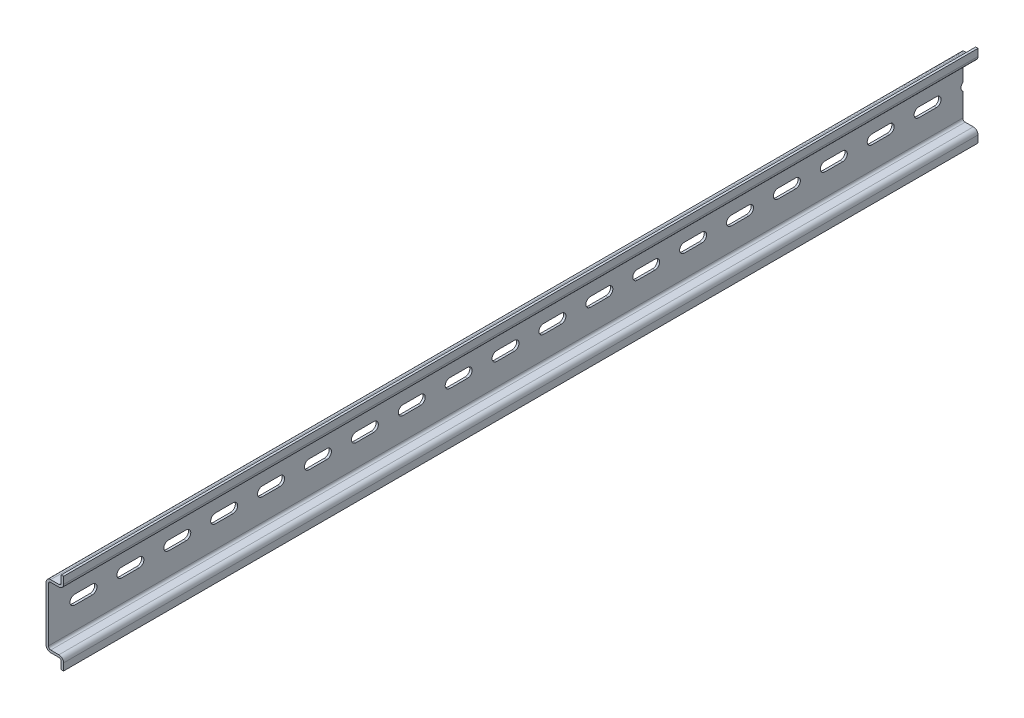
from build123d import *

# Parameters (mm, degrees)
EXTRUDE_1_DEPTH        = 195
CUT_EXTRUDE_1_DEPTH    = 10
PATTERN_LINEAR_1_COUNT = 50
PATTERN_LINEAR_1_PITCH = 20


with BuildPart() as part:
    # 草图1 → 凸台-拉伸1 (new, symmetric)
    with BuildSketch(Plane.XY):
        with BuildLine():
            Line((0, 19.218912653), (1, 19.218912653))
            Line((1, 19.218912653), (1, 16.218912653))
            ThreePointArc((1, 16.218912653), (0.414213562, 14.80469909), (-1, 14.218912653))
            Line((-1, 14.218912653), (-4.5, 14.218912653))
            ThreePointArc((-4.5, 14.218912653), (-5.207106781, 13.926019434), (-5.5, 13.218912653))
            Line((-5.5, 13.218912653), (-5.5, -9.781087347))
            ThreePointArc((-5.5, -9.781087347), (-5.207106781, -10.488194128), (-4.5, -10.781087347))
            Line((-4.5, -10.781087347), (-1, -10.781087347))
            ThreePointArc((-1, -10.781087347), (0.414213562, -11.366873785), (1, -12.781087347))
            Line((1, -12.781087347), (1, -15.781087347))
            Line((1, -15.781087347), (0, -15.781087347))
            Line((0, -15.781087347), (0, -12.781087347))
            ThreePointArc((0, -12.781087347), (-0.292893219, -12.073980566), (-1, -11.781087347))
            Line((-1, -11.781087347), (-4.5, -11.781087347))
            ThreePointArc((-4.5, -11.781087347), (-5.914213562, -11.19530091), (-6.5, -9.781087347))
            Line((-6.5, -9.781087347), (-6.5, 13.218912653))
            ThreePointArc((-6.5, 13.218912653), (-5.914213562, 14.633126215), (-4.5, 15.218912653))
            Line((-4.5, 15.218912653), (-1, 15.218912653))
            ThreePointArc((-1, 15.218912653), (-0.292893219, 15.511805872), (0, 16.218912653))
            Line((0, 16.218912653), (0, 19.218912653))
        make_face()
    extrude(amount=EXTRUDE_1_DEPTH, both=True)

    # 草图2 → 切除-拉伸1 (cut)
    with BuildSketch(Plane(origin=(-5.5, 0, 0), x_dir=(0, 0, -1), z_dir=(1, 0, 0))):
        with BuildLine():
            Line((-183.75, 3.718912653), (-176.25, 3.718912653))
            ThreePointArc((-176.25, 3.718912653), (-174.25, 1.718912653), (-176.25, -0.281087347))
            Line((-176.25, -0.281087347), (-183.75, -0.281087347))
            ThreePointArc((-183.75, -0.281087347), (-185.75, 1.718912653), (-183.75, 3.718912653))
        make_face()
    cut_extrude_1 = extrude(amount=-CUT_EXTRUDE_1_DEPTH, mode=Mode.SUBTRACT)

    # 阵列(线性)1: 切除-拉伸1 ×50
    with Locations(*[(0, 0, -i * PATTERN_LINEAR_1_PITCH) for i in range(1, PATTERN_LINEAR_1_COUNT)]):
        add(cut_extrude_1, mode=Mode.SUBTRACT)


solid = part.part
